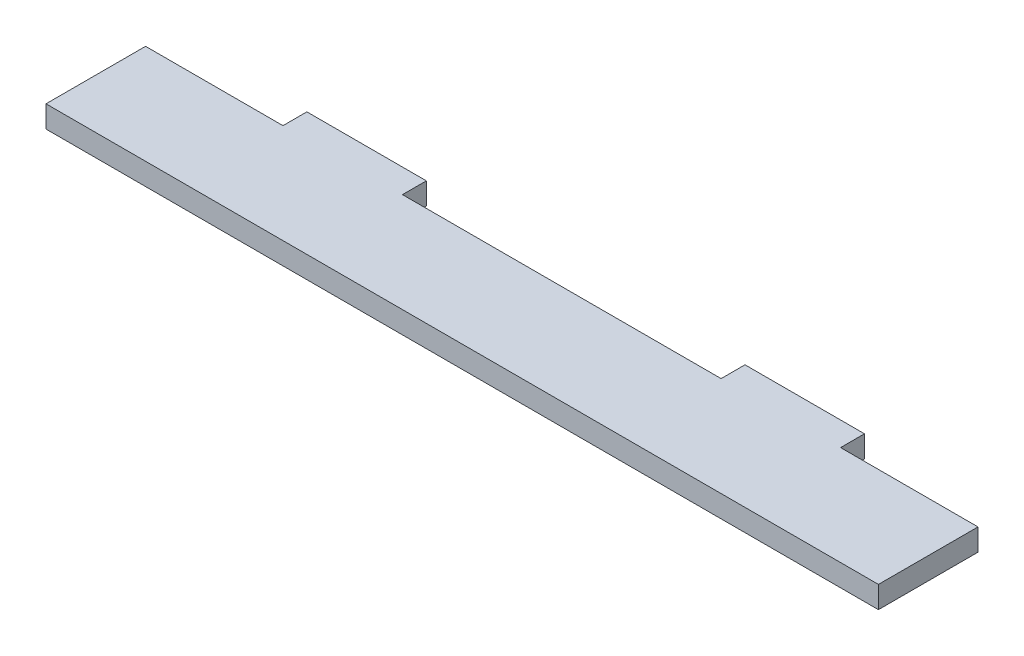
from build123d import *

# Parameters (mm, degrees)
SKETCH1_W           = 30
SKETCH1_H           = 6
SKETCH1_W_2         = 209
SKETCH1_H_2         = 25
BOSS_EXTRUDE1_DEPTH = 5.5


with BuildPart() as part:
    # Sketch1 → Boss-Extrude1 (new body)
    with BuildSketch(Plane(origin=(0, 0, 0), x_dir=(1, 0, 0), z_dir=(0, 1, 0))):
        with Locations((-55, 15.5)):
            Rectangle(SKETCH1_W, SKETCH1_H)
        Rectangle(SKETCH1_W_2, SKETCH1_H_2)
        with Locations((55, 15.5)):
            Rectangle(SKETCH1_W, SKETCH1_H)
    extrude(amount=BOSS_EXTRUDE1_DEPTH)


solid = part.part
